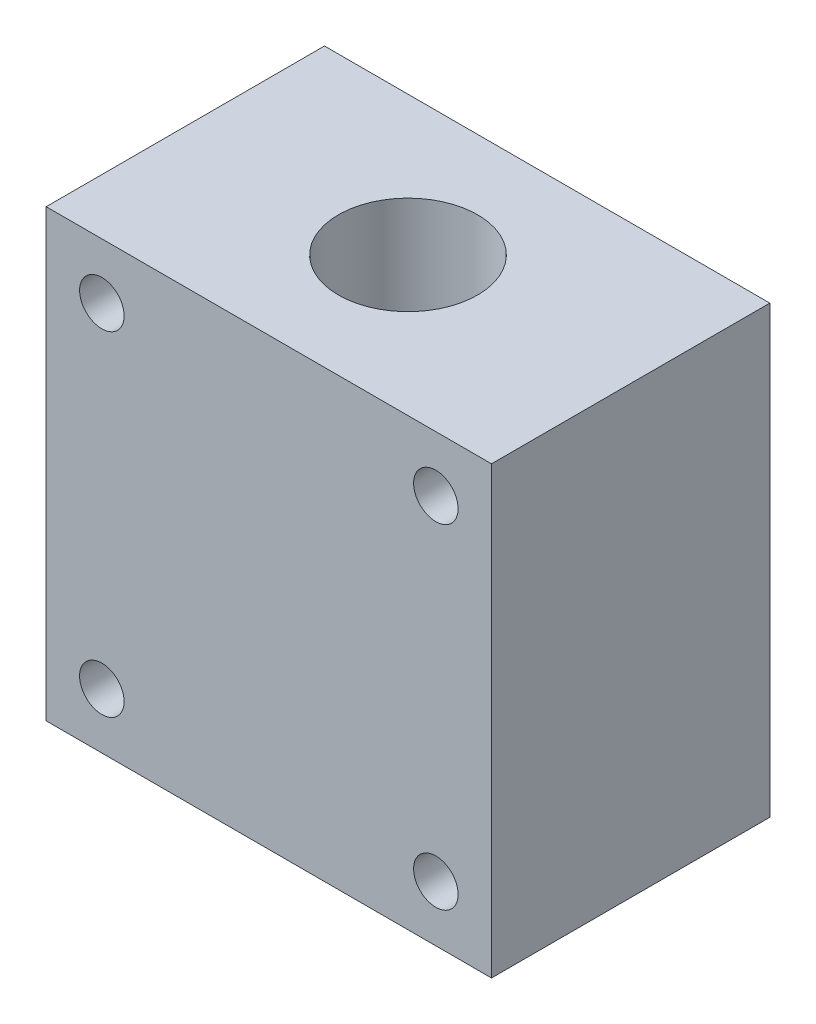
from build123d import *

# Parameters (mm, degrees)
SKETCH1_W           = 80
SKETCH1_H           = 50
BOSS_EXTRUDE1_DEPTH = 80
SKETCH2_R           = 12.5
CUT_EXTRUDE1_DEPTH  = 93.870878105
CUT_EXTRUDE2_DEPTH  = 103.46950766


with BuildPart() as part:
    # Sketch1 → Boss-Extrude1 (new body)
    with BuildSketch(Plane(origin=(0, 0, 0), x_dir=(1, 0, 0), z_dir=(0, 1, 0))):
        Rectangle(SKETCH1_W, SKETCH1_H)
    extrude(amount=BOSS_EXTRUDE1_DEPTH)

    # Sketch2 → Cut-Extrude1 (cut, through all)
    with BuildSketch(Plane(origin=(0, 80, 0), x_dir=(1, 0, 0), z_dir=(0, 1, 0))):
        with Locations(Location((0, 0, 0), (0, 0, 270))):
            Circle(SKETCH2_R)
    extrude(amount=-CUT_EXTRUDE1_DEPTH, mode=Mode.SUBTRACT)

    # Sketch3 → Cut-Extrude2 (cut, through all)
    with BuildSketch(Plane.XY.offset(25)):
        with BuildLine():
            ThreePointArc((-26, 70), (-32.828427125, 72.828427125), (-30, 66))
            Line((-30, 66), (-30, 70))
            Line((-30, 70), (-26, 70))
        make_face()
        with BuildLine():
            Line((-30, 70), (-30, 66))
            ThreePointArc((-30, 66), (-27.171572875, 67.171572875), (-26, 70))
            Line((-26, 70), (-30, 70))
        make_face()
        with BuildLine():
            ThreePointArc((-30, 14), (-32.828427125, 7.171572875), (-26, 10))
            Line((-26, 10), (-30, 10))
            Line((-30, 10), (-30, 14))
        make_face()
        with BuildLine():
            Line((-30, 10), (-26, 10))
            ThreePointArc((-26, 10), (-27.171572875, 12.828427125), (-30, 14))
            Line((-30, 14), (-30, 10))
        make_face()
        with BuildLine():
            ThreePointArc((30, 14), (27.171572875, 12.828427125), (26, 10))
            Line((26, 10), (30, 10))
            Line((30, 10), (30, 14))
        make_face()
        with BuildLine():
            Line((30, 10), (26, 10))
            ThreePointArc((26, 10), (30, 6), (34, 10))
            ThreePointArc((34, 10), (32.828427125, 12.828427125), (30, 14))
            Line((30, 14), (30, 10))
        make_face()
        with BuildLine():
            ThreePointArc((26, 70), (27.171572875, 67.171572875), (30, 66))
            Line((30, 66), (30, 70))
            Line((30, 70), (26, 70))
        make_face()
        with BuildLine():
            Line((30, 70), (30, 66))
            ThreePointArc((30, 66), (32.828427125, 67.171572875), (34, 70))
            ThreePointArc((34, 70), (30, 74), (26, 70))
            Line((26, 70), (30, 70))
        make_face()
    extrude(amount=-CUT_EXTRUDE2_DEPTH, mode=Mode.SUBTRACT)


solid = part.part
